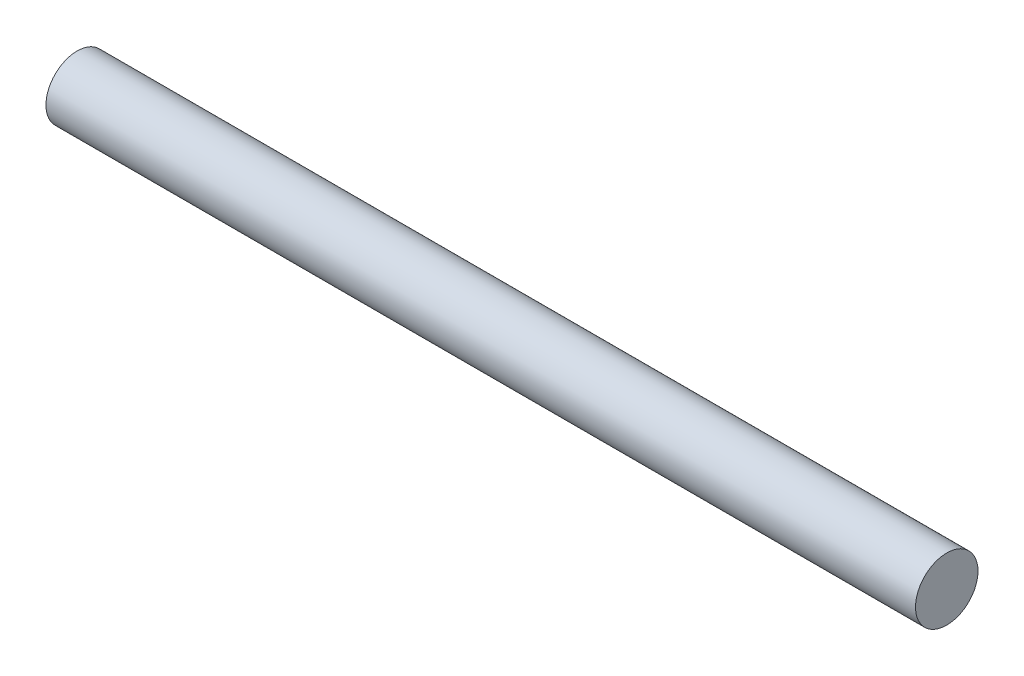
from build123d import *

# Parameters (mm, degrees)
SKETCH1_R           = 1.5
BOSS_EXTRUDE1_DEPTH = 41.73


with BuildPart() as part:
    # Sketch1 → Boss-Extrude1 (new body)
    with BuildSketch(Plane(origin=(0, 0, 0), x_dir=(0, 0, -1), z_dir=(1, 0, 0))):
        Circle(SKETCH1_R)
    extrude(amount=BOSS_EXTRUDE1_DEPTH)


solid = part.part
